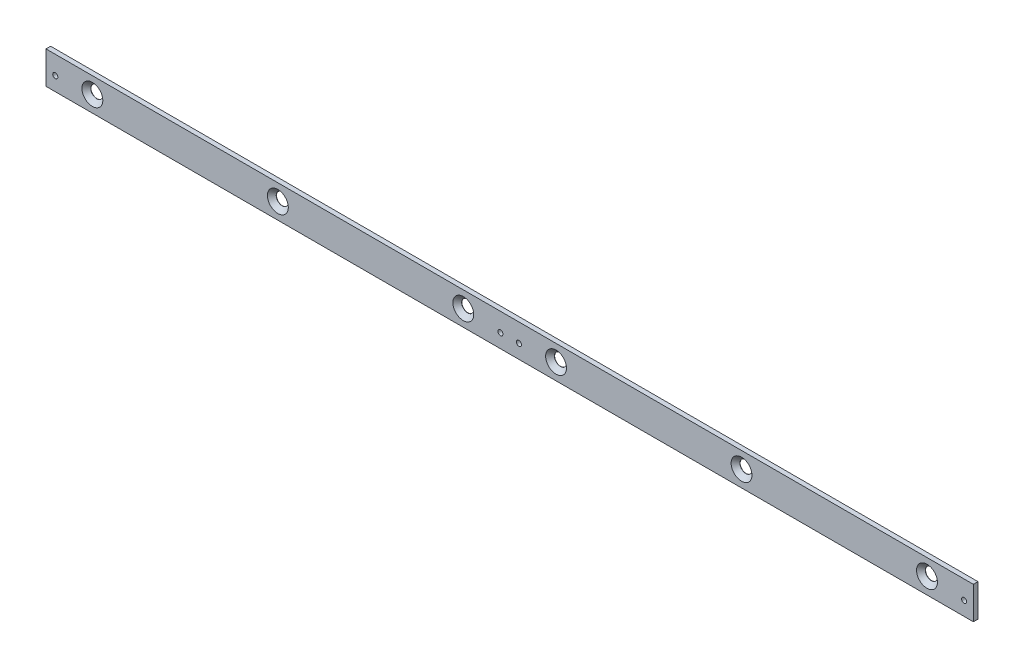
from build123d import *

# Parameters (mm, degrees)
SKETCH_1_W      = 400
SKETCH_1_H      = 14
SKETCH_1_R      = 2.6
SKETCH_1_R_2    = 1.1
EXTRUDE_1_DEPTH = 2
CHAMFER_1_SIZE  = 1.9


with BuildPart() as part:
    # Эскиз1 → Вытянуть1 (new body)
    with BuildSketch(Plane.XY):
        Rectangle(SKETCH_1_W, SKETCH_1_H)
        with Locations(Location((-180, 0, 0), (0, 0, 180))):
            Circle(SKETCH_1_R, mode=Mode.SUBTRACT)
        with Locations(Location((-100, 0, 0), (0, 0, 180))):
            Circle(SKETCH_1_R, mode=Mode.SUBTRACT)
        with Locations(Location((-20, 0, 0), (0, 0, 180))):
            Circle(SKETCH_1_R, mode=Mode.SUBTRACT)
        with Locations(Location((20, 0, 0), (0, 0, 180))):
            Circle(SKETCH_1_R, mode=Mode.SUBTRACT)
        with Locations(Location((100, 0, 0), (0, 0, 180))):
            Circle(SKETCH_1_R, mode=Mode.SUBTRACT)
        with Locations(Location((180, 0, 0), (0, 0, 180))):
            Circle(SKETCH_1_R, mode=Mode.SUBTRACT)
        with Locations((-196, -1)):
            Circle(SKETCH_1_R_2, mode=Mode.SUBTRACT)
        with Locations((-4, -1)):
            Circle(SKETCH_1_R_2, mode=Mode.SUBTRACT)
        with Locations(Location((4, -1, 0), (0, 0, 180))):
            Circle(SKETCH_1_R_2, mode=Mode.SUBTRACT)
        with Locations(Location((196, -1, 0), (0, 0, 180))):
            Circle(SKETCH_1_R_2, mode=Mode.SUBTRACT)
    extrude(amount=EXTRUDE_1_DEPTH)

    # Фаска1
    chamfer_1_edges = [part.edges().sort_by_distance(p)[0] for p in [
        (-177.4, 0, 2),
        (-97.4, 0, 2),
        (-17.4, 0, 2),
        (22.6, 0, 2),
        (102.6, 0, 2),
        (182.6, 0, 2),
    ]]
    chamfer(chamfer_1_edges, length=CHAMFER_1_SIZE)


solid = part.part
